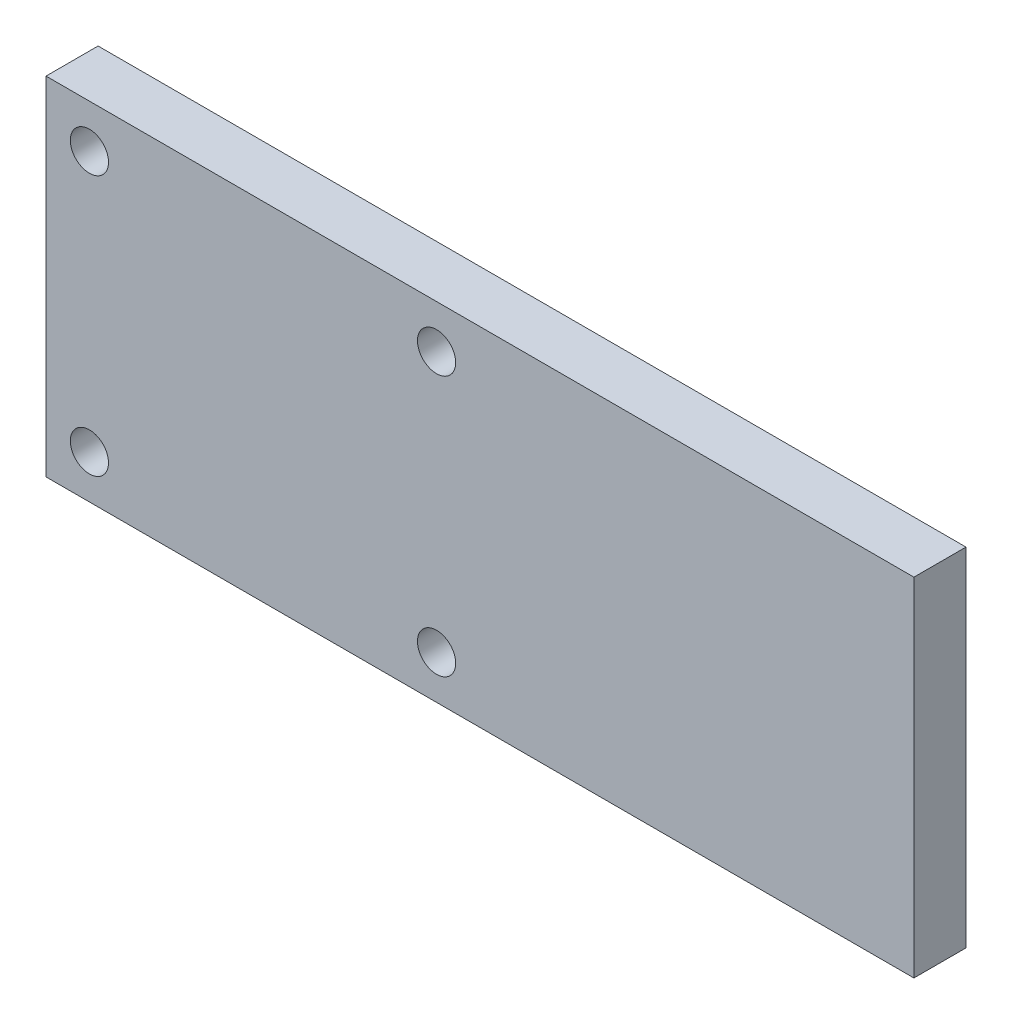
from build123d import *

# Parameters (mm, degrees)
SKETCH1_W           = 100
SKETCH1_H           = 40
SKETCH1_R           = 2.2
BOSS_EXTRUDE1_DEPTH = 6


with BuildPart() as part:
    # Sketch1 → Boss-Extrude1 (new body)
    with BuildSketch(Plane.XY.offset(9)):
        with Locations((65, 34)):
            Rectangle(SKETCH1_W, SKETCH1_H)
        with Locations((60, 49)):
            Circle(SKETCH1_R, mode=Mode.SUBTRACT)
        with Locations((20, 19)):
            Circle(SKETCH1_R, mode=Mode.SUBTRACT)
        with Locations((20, 49)):
            Circle(SKETCH1_R, mode=Mode.SUBTRACT)
        with Locations((60, 19)):
            Circle(SKETCH1_R, mode=Mode.SUBTRACT)
    extrude(amount=-BOSS_EXTRUDE1_DEPTH)


solid = part.part
